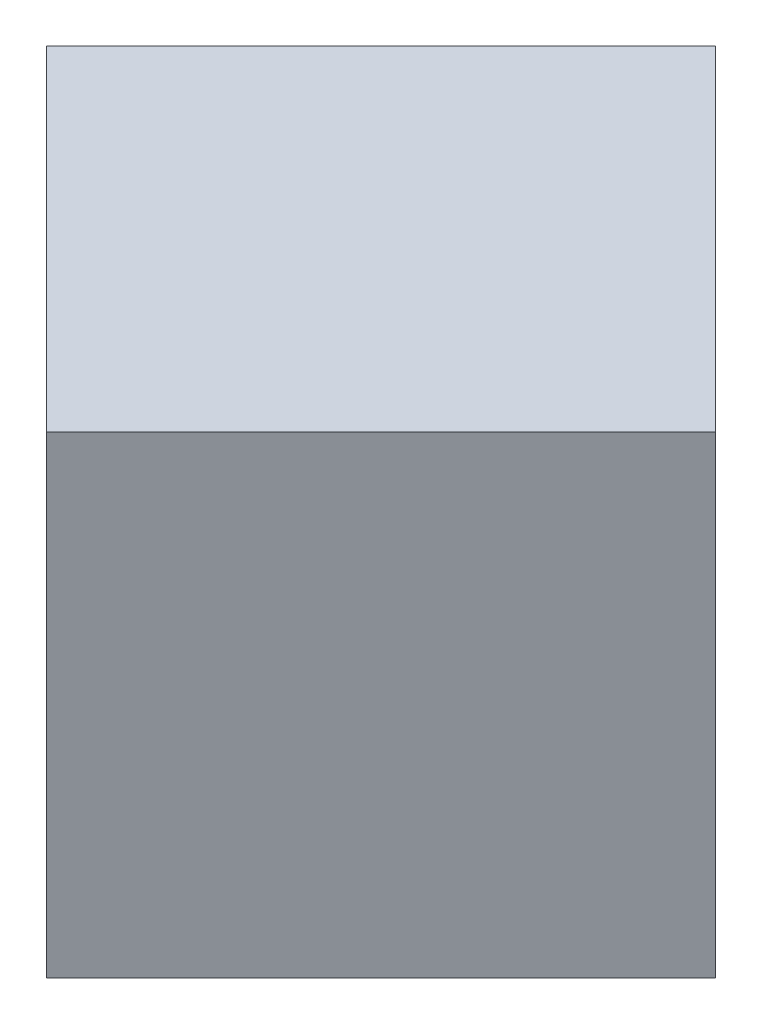
from build123d import *

# Parameters (mm, degrees)
BOSS_EXTRUDE3_DEPTH = 65


with BuildPart() as part:
    # Sketch1 → Boss-Extrude3 (new body)
    with BuildSketch(Plane(origin=(0, 0, 0), x_dir=(1, 0, 0), z_dir=(0, 1, 0))):
        Polygon((0, -45.961940777), (45.961940777, 0), (0, 45.961940777), (-45.961940777, 0), align=None)
    extrude(amount=BOSS_EXTRUDE3_DEPTH)


solid = part.part
